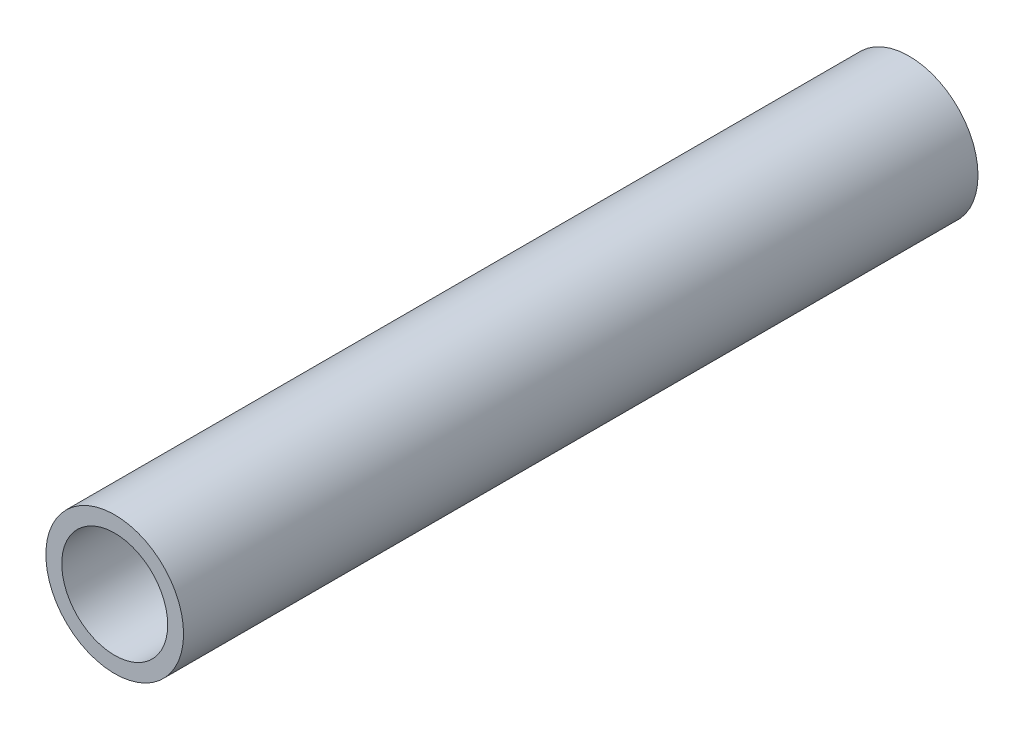
from build123d import *

# Parameters (mm, degrees)
SKETCH1_R           = 16.51
SKETCH1_R_2         = 12.7
BOSS_EXTRUDE1_DEPTH = 190.5


with BuildPart() as part:
    # Sketch1 → Boss-Extrude1 (new body)
    with BuildSketch(Plane.XY):
        Circle(SKETCH1_R)
        Circle(SKETCH1_R_2, mode=Mode.SUBTRACT)
    extrude(amount=BOSS_EXTRUDE1_DEPTH)


solid = part.part
